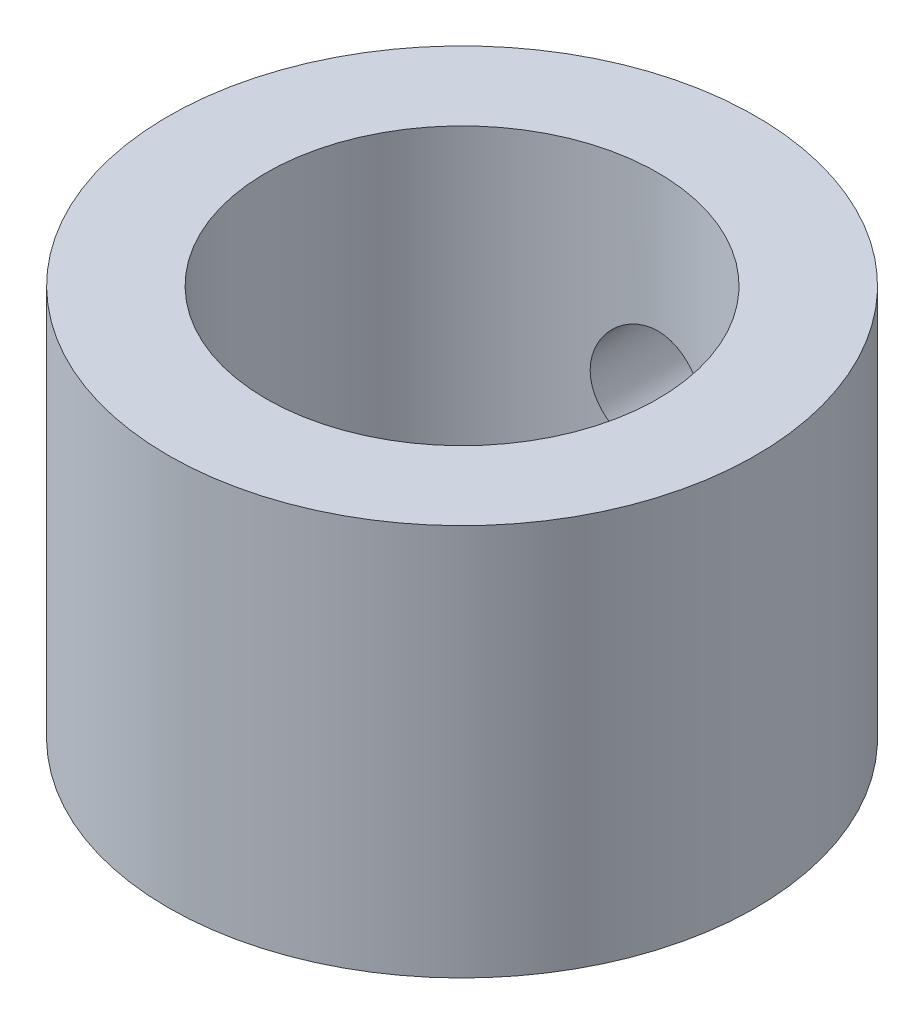
from build123d import *

# Parameters (mm, degrees)
SKETCH1_R               = 7.5
SKETCH1_R_2             = 5
BOSS_EXTRUDE1_DEPTH     = 5
CUT_EXTRUDE1_REACH      = 13.726
CUT_EXTRUDE1_END_RADIUS = 7.5
SKETCH2_R               = 1.5


with BuildPart() as part:
    # Sketch1 → Boss-Extrude1 (new, symmetric)
    with BuildSketch(Plane(origin=(0, 0, 0), x_dir=(1, 0, 0), z_dir=(0, 1, 0))):
        with Locations(Location((0, 0, 0), (0, 0, 270))):
            Circle(SKETCH1_R)
        with Locations(Location((0, 0, 0), (0, 0, 270))):
            Circle(SKETCH1_R_2, mode=Mode.SUBTRACT)
    extrude(amount=BOSS_EXTRUDE1_DEPTH, both=True)

    # Cut-Extrude1: up to this cylinder (the profile starts inside it)
    cut_extrude1_end = Plane(origin=(0, 0, 0), z_dir=(0, -1, 0)) * Cylinder(CUT_EXTRUDE1_END_RADIUS, 43.452, mode=Mode.PRIVATE)
    # Sketch2 → Cut-Extrude1 (cut, up to the surface)
    with BuildSketch(Plane.XY, mode=Mode.PRIVATE) as cut_extrude1_sk1:
        Circle(SKETCH2_R)
    cut_extrude1_tool1 = extrude(cut_extrude1_sk1.sketch, amount=-CUT_EXTRUDE1_REACH, mode=Mode.PRIVATE) & cut_extrude1_end
    add(cut_extrude1_tool1.solids().sort_by_distance((0, 0, 0))[0], mode=Mode.SUBTRACT)


solid = part.part
